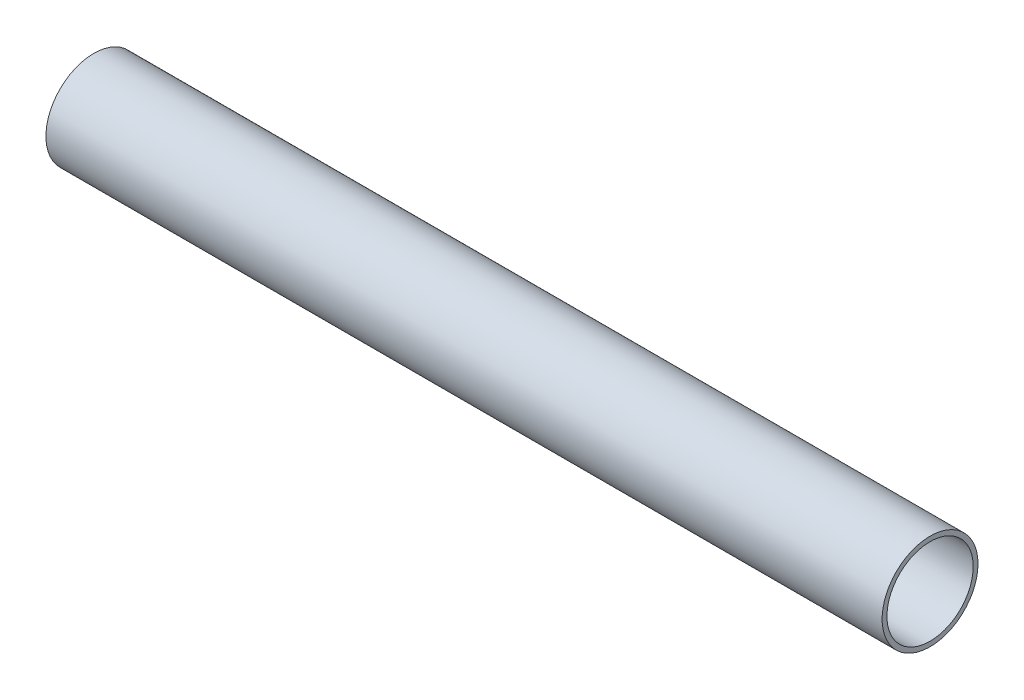
from build123d import *

# Parameters (mm, degrees)
SKETCH1_R           = 15.875
SKETCH1_R_2         = 14.2875
EXTRUDE_THIN1_DEPTH = 138.463505902


with BuildPart() as part:
    # Sketch1 → Extrude-Thin1 (new, symmetric)
    with BuildSketch(Plane(origin=(0, 0, 0), x_dir=(0, 0, -1), z_dir=(1, 0, 0))):
        Circle(SKETCH1_R)
        Circle(SKETCH1_R_2, mode=Mode.SUBTRACT)
    extrude(amount=EXTRUDE_THIN1_DEPTH, both=True)


solid = part.part
